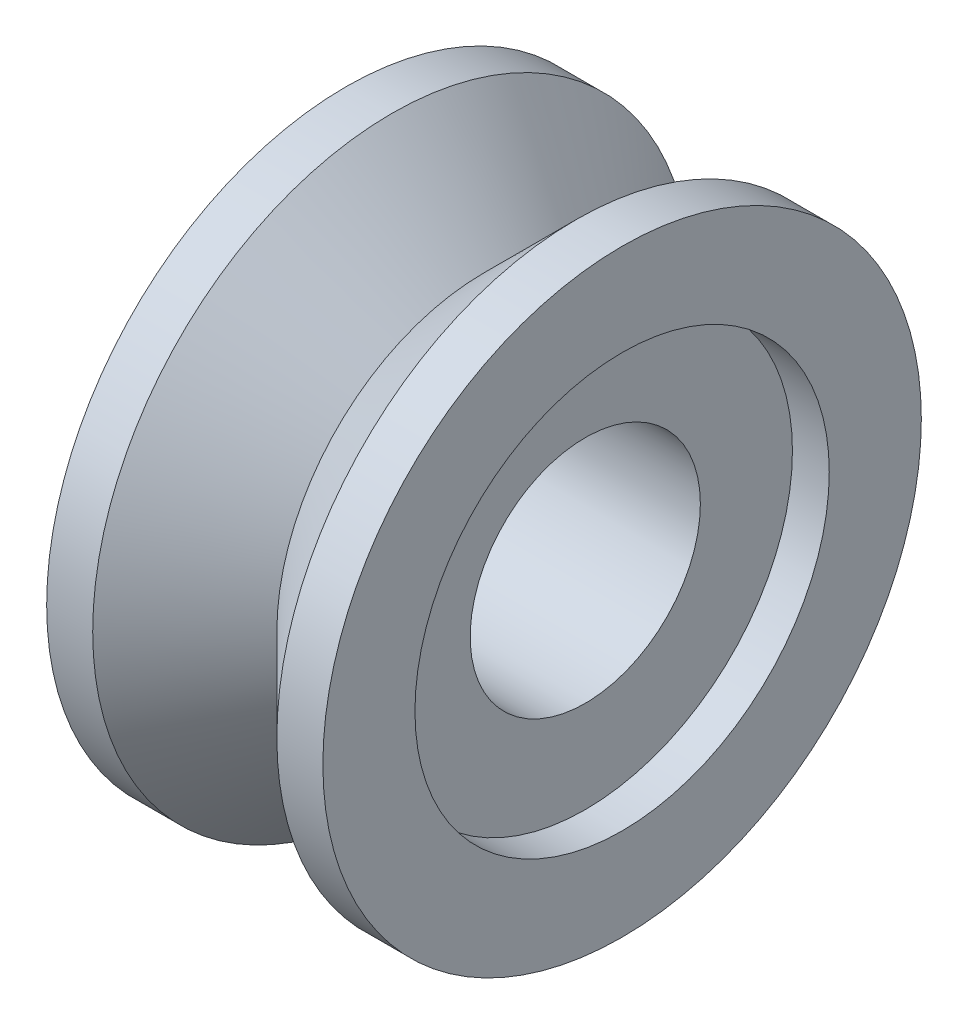
from build123d import *

# Parameters (mm, degrees)
SKETCH1_R               = 6.5
BOSS_EXTRUDE1_DEPTH     = 3
SKETCH4_R               = 4.5
CUT_EXTRUDE1_DEPTH      = 0.8
CUT_EXTRUDE2_DEPTH      = 10.669539803
CUT_EXTRUDE2_DEPTH_BACK = 10.669539803
SKETCH5_R               = 2.5


with BuildPart() as part:
    # Sketch1 → Boss-Extrude1 (new, symmetric)
    with BuildSketch(Plane(origin=(0, 0, 0), x_dir=(0, 0, -1), z_dir=(1, 0, 0))):
        Circle(SKETCH1_R)
    extrude(amount=BOSS_EXTRUDE1_DEPTH, both=True)

    # Sketch2 → Cut-Revolve1 (revolve, cut)
    with BuildSketch(Plane.XY):
        Polygon((-2, 6.5), (0, 4.5), (2, 6.5), align=None)
    revolve(axis=Axis((3, 0, 0), (-1, 0, 0)), mode=Mode.SUBTRACT)

    # Sketch4 → Cut-Extrude1 (cut)
    with BuildSketch(Plane(origin=(3, 0, 0), x_dir=(0, 0, -1), z_dir=(1, 0, 0))):
        Circle(SKETCH4_R)
    cut_extrude1 = extrude(amount=-CUT_EXTRUDE1_DEPTH, mode=Mode.SUBTRACT)

    # Mirror1: Cut-Extrude1 across plane
    add(cut_extrude1.mirror(Plane(origin=(0, 0, 0), x_dir=(0, 0, 1), z_dir=(1, 0, 0))), mode=Mode.SUBTRACT)

    # Sketch5 → Cut-Extrude2 (cut, two sides: drawn at the far end of the back side and taken through both)
    with BuildSketch(Plane(origin=(0, 0, 0), x_dir=(0, 0, -1), z_dir=(1, 0, 0)).offset(-CUT_EXTRUDE2_DEPTH_BACK)):
        Circle(SKETCH5_R)
    extrude(amount=CUT_EXTRUDE2_DEPTH + CUT_EXTRUDE2_DEPTH_BACK, mode=Mode.SUBTRACT)


solid = part.part
